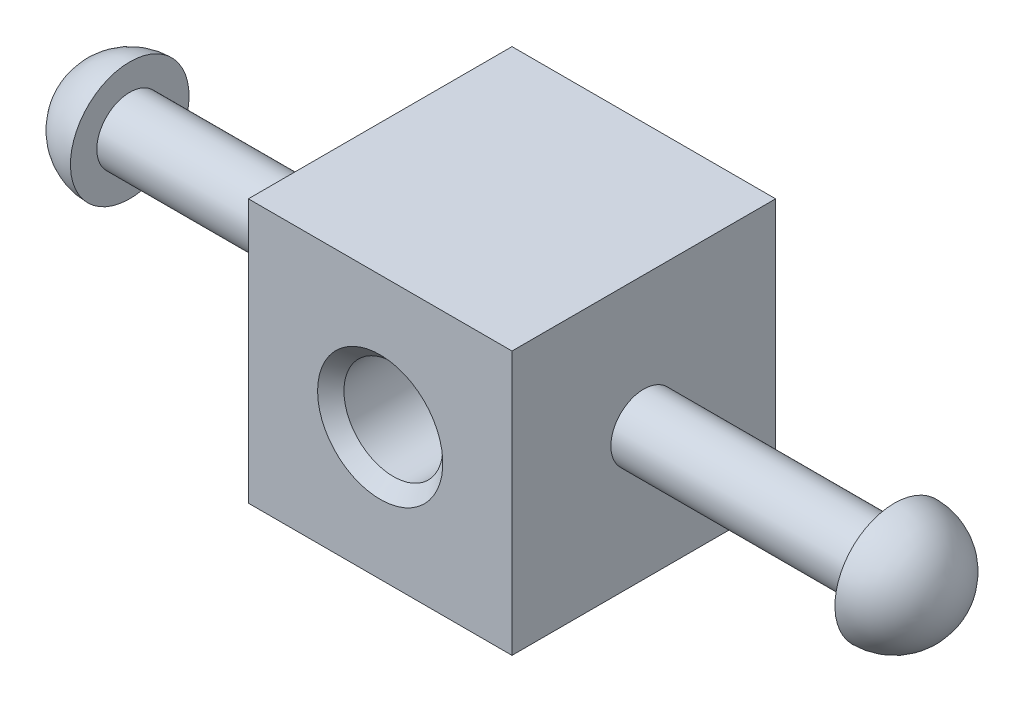
from build123d import *

# Parameters (mm, degrees)
SKETCH1_W           = 25.4
SKETCH1_H           = 25.4
SKETCH1_R           = 4.7625
BOSS_EXTRUDE1_DEPTH = 12.7
CHAMFER1_SIZE       = 1.27


with BuildPart() as part:
    # Sketch1 → Boss-Extrude1 (new, symmetric)
    with BuildSketch(Plane.XY):
        Rectangle(SKETCH1_W, SKETCH1_H)
        Circle(SKETCH1_R, mode=Mode.SUBTRACT)
    extrude(amount=BOSS_EXTRUDE1_DEPTH, both=True)

    # Chamfer1
    chamfer1_edges = [part.edges().sort_by_distance(p)[0] for p in [
        (-4.7625, 0, -12.7),
        (-4.7625, 0, 12.7),
    ]]
    chamfer(chamfer1_edges, length=CHAMFER1_SIZE)

    # Sketch2 → Revolve1 (revolve)
    with BuildSketch(Plane.XY, mode=Mode.PRIVATE) as revolve1_sk:
        with BuildLine():
            Line((12.7, 3.175), (36.83, 3.175))
            Line((36.83, 3.175), (36.83, 5.715))
            ThreePointArc((36.83, 5.715), (40.871115254, 4.041115254), (42.545, 0))
            Line((42.545, 0), (12.7, 0))
            Line((12.7, 0), (12.7, 3.175))
        make_face()
    revolve1 = revolve(revolve1_sk.sketch.rotate(Axis((42.545, 0, 0), (-1, 0, 0)), 90), axis=Axis((42.545, 0, 0), (-1, 0, 0)))

    # Mirror1: Revolve1 across plane
    add(revolve1.mirror(Plane(origin=(0, 0, 0), x_dir=(0, 0, 1), z_dir=(1, 0, 0))))


solid = part.part
